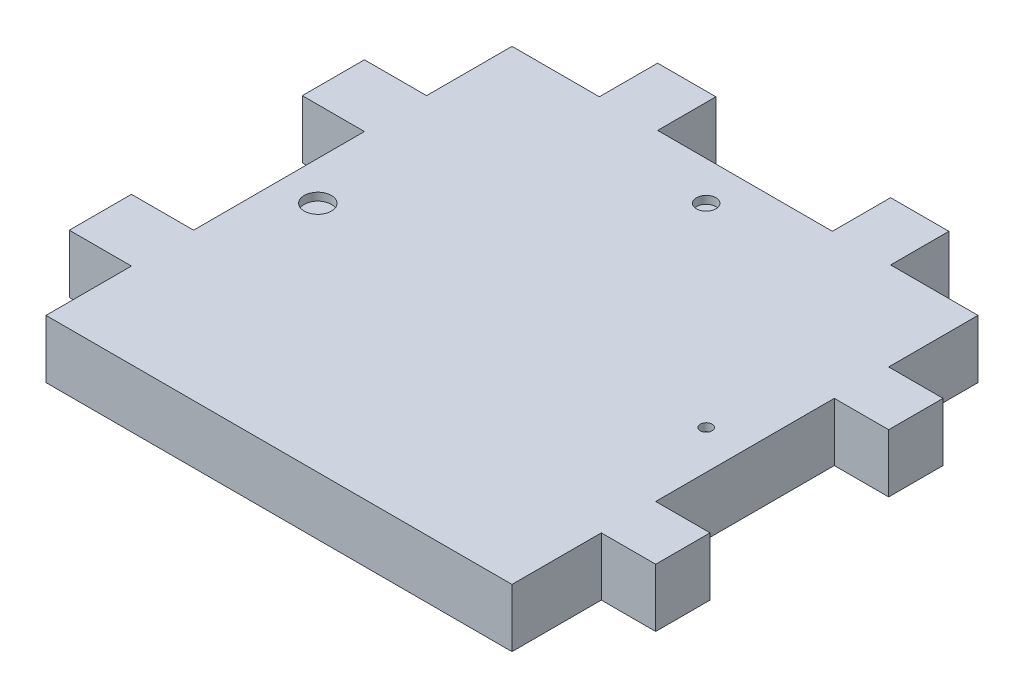
from build123d import *

# Parameters (mm, degrees)
SKETCH1_W           = 152.4
SKETCH1_H           = 152.4
SKETCH1_W_2         = 20.32
SKETCH1_H_2         = 20.32
SKETCH1_W_3         = 19.05
SKETCH1_H_3         = 19.05
SKETCH1_W_4         = 17.78
SKETCH1_H_4         = 17.78
BOSS_EXTRUDE1_DEPTH = 19.05
SKETCH2_R           = 1.905
SKETCH2_R_2         = 3.175
SKETCH2_R_3         = 4.445
CUT_EXTRUDE1_DEPTH  = 2.54


with BuildPart() as part:
    # Sketch1 → Boss-Extrude1 (new body)
    with BuildSketch(Plane(origin=(0, 0, 0), x_dir=(1, 0, 0), z_dir=(0, 1, 0))):
        Rectangle(SKETCH1_W, SKETCH1_H)
        with Locations((-86.36, -38.1)):
            Rectangle(SKETCH1_W_2, SKETCH1_H_2)
        with Locations((-86.36, 38.1)):
            Rectangle(SKETCH1_W_2, SKETCH1_H_2)
        with Locations((-38.1, 85.725)):
            Rectangle(SKETCH1_W_3, SKETCH1_H_3)
        with Locations((38.1, 85.725)):
            Rectangle(SKETCH1_W_3, SKETCH1_H_3)
        with Locations((85.09, 38.1)):
            Rectangle(SKETCH1_W_4, SKETCH1_H_4)
        with Locations((85.09, -38.1)):
            Rectangle(SKETCH1_W_4, SKETCH1_H_4)
    extrude(amount=BOSS_EXTRUDE1_DEPTH)

    # Sketch2 → Cut-Extrude1 (cut)
    with BuildSketch(Plane(origin=(0, 19.05, 0), x_dir=(1, 0, 0), z_dir=(0, 1, 0))):
        with Locations(Location((63.5, 0, 0), (0, 0, 270))):
            Circle(SKETCH2_R)
        with Locations(Location((0, 63.5, 0), (0, 0, 270))):
            Circle(SKETCH2_R_2)
        with Locations(Location((-63.5, 0, 0), (0, 0, 270))):
            Circle(SKETCH2_R_3)
    extrude(amount=-CUT_EXTRUDE1_DEPTH, mode=Mode.SUBTRACT)


solid = part.part
